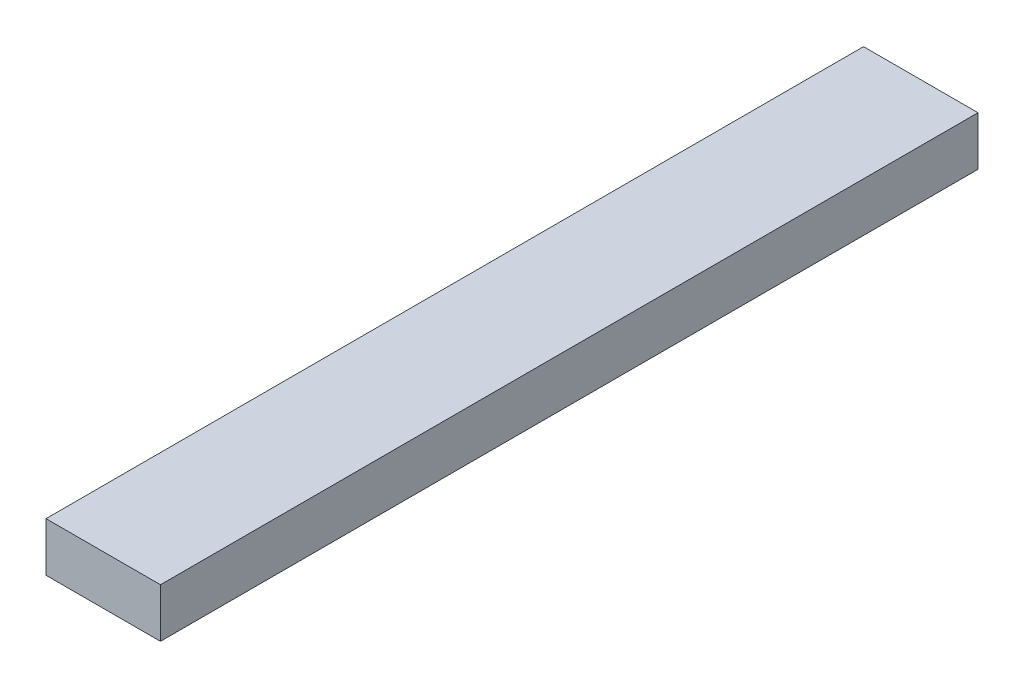
from build123d import *

# Parameters (mm, degrees)
SKETCH1_W           = 88.9
SKETCH1_H           = 38.1
BOSS_EXTRUDE1_DEPTH = 635


with BuildPart() as part:
    # Sketch1 → Boss-Extrude1 (new body)
    with BuildSketch(Plane.XY):
        with Locations((44.45, -19.05)):
            Rectangle(SKETCH1_W, SKETCH1_H)
    extrude(amount=BOSS_EXTRUDE1_DEPTH)


solid = part.part
